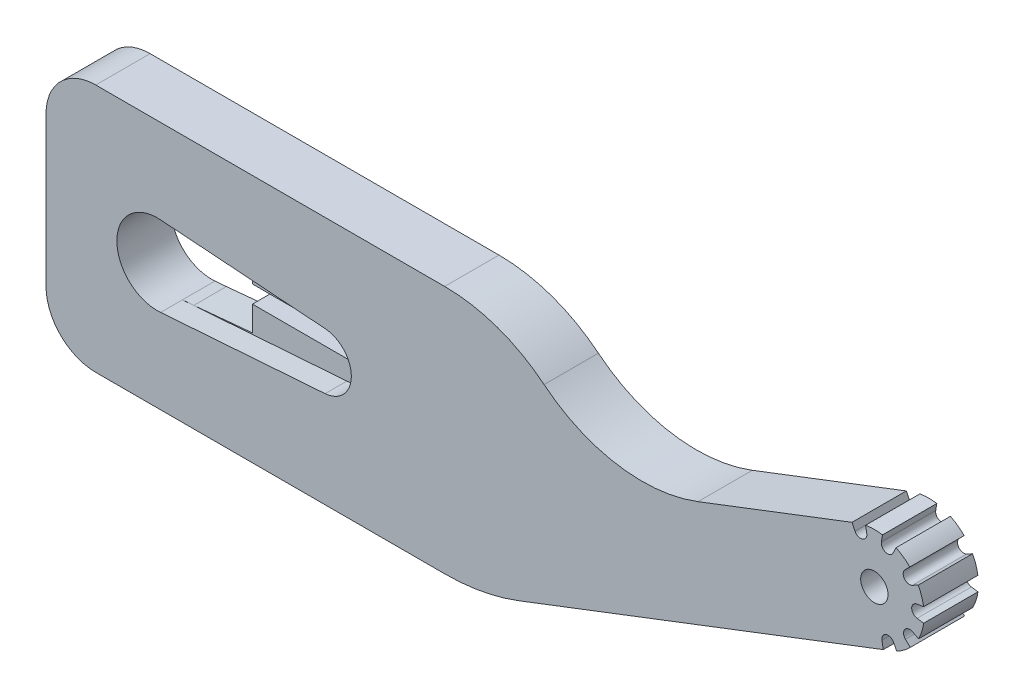
from build123d import *
from build123d.topology import SkipClean

# Parameters (mm, degrees)
CROQUIS1_R              = 1.717841821
CROQUIS1_R_2            = 1.259750669
CROQUIS1_W              = 27.485469141
CROQUIS1_H              = 14.887962451
SALIENTE_EXTRUIR1_DEPTH = 5
SALIENTE_EXTRUIR2_START = -5
SALIENTE_EXTRUIR2_DEPTH = 5
CORTAR_EXTRUIR1_DEPTH   = 5
CORTAR_EXTRUIR2_DEPTH   = 2
CUT_EXTRUDE2_DEPTH      = 83.704538261
CUT_EXTRUDE5_DEPTH      = 83.704538261


with BuildPart() as part:
    # Croquis1 → Saliente-Extruir1 (new body)
    with BuildSketch(Plane(origin=(0, 0, -2.5), x_dir=(-1, 0, 0), z_dir=(0, 0, -1))):
        with BuildLine():
            Line((2.183126414, 10.199004786), (2.457799007, 10.747834714))
            ThreePointArc((2.457799007, 10.747834714), (3.150356623, 11.03498533), (3.533498829, 10.390552574))
            Line((3.533498829, 10.390552574), (3.410556906, 9.704532228))
            Line((3.410556906, 9.704532228), (36.957948904, -3.17310503))
            ThreePointArc((36.957948904, -3.17310503), (40.309989238, -4.118478177), (43.778179918, -4.437160132))
            Line((43.778179918, -4.437160132), (75.884737747, -4.437160132))
            ThreePointArc((75.884737747, -4.437160132), (79.123931349, -3.095442211), (80.46564927, 0.143751392))
            Line((80.46564927, 0.143751392), (80.46564927, 13.886485962))
            ThreePointArc((80.46564927, 13.886485962), (79.123931349, 17.125679564), (75.884737747, 18.467397485))
            Line((75.884737747, 18.467397485), (43.778179918, 18.467397485))
            ThreePointArc((43.778179918, 18.467397485), (38.923372817, 17.631925595), (34.62713443, 15.221634951))
            ThreePointArc((34.62713443, 15.221634951), (27.84817952, 12.197288027), (20.46564927, 12.971336544))
            Line((20.46564927, 12.971336544), (6.293279019, 18.411599775))
            Line((6.293279019, 18.411599775), (6.008822105, 17.843219559))
            ThreePointArc((6.008822105, 17.843219559), (5.316264489, 17.556068943), (4.933122282, 18.200501699))
            Line((4.933122282, 18.200501699), (5.041383533, 18.804603367))
            ThreePointArc((5.041383533, 18.804603367), (4.263160644, 18.876341405), (3.484068945, 18.814751339))
            Line((3.484068945, 18.814751339), (3.584448287, 18.209290101))
            ThreePointArc((3.584448287, 18.209290101), (3.192940304, 17.56990522), (2.504183677, 17.866056933))
            Line((2.504183677, 17.866056933), (2.236686818, 18.418419815))
            ThreePointArc((2.236686818, 18.418419815), (1.564924714, 18.019029169), (0.970828021, 17.511263148))
            Line((0.970828021, 17.511263148), (1.407917802, 17.080436215))
            ThreePointArc((1.407917802, 17.080436215), (1.467002194, 16.333040361), (0.735712768, 16.167791142))
            Line((0.735712768, 16.167791142), (0.194632507, 16.457431391))
            ThreePointArc((0.194632507, 16.457431391), (-0.114078519, 15.739465714), (-0.296255461, 14.9794731))
            Line((-0.296255461, 14.9794731), (0.310591317, 14.887841716))
            ThreePointArc((0.310591317, 14.887841716), (0.797699855, 14.317914702), (0.303205335, 13.754384137))
            Line((0.303205335, 13.754384137), (-0.304784058, 13.670669023))
            ThreePointArc((-0.304784058, 13.670669023), (-0.132526888, 12.9083668), (0.16680132, 12.18643894))
            Line((0.16680132, 12.18643894), (0.711610253, 12.469003179))
            ThreePointArc((0.711610253, 12.469003179), (1.440684032, 12.294237755), (1.371864517, 11.547675365))
            Line((1.371864517, 11.547675365), (0.929197275, 11.122581216))
            ThreePointArc((0.929197275, 11.122581216), (1.516626257, 10.607115987), (2.183126414, 10.199004786))
        make_face()
        with Locations(Location((46.05155145, 7.015118677, 0), (0, 0, 180))):
            Circle(CROQUIS1_R, mode=Mode.SUBTRACT)
        with Locations(Location((77.659840962, 7.015118677, 0), (0, 0, 180))):
            Circle(CROQUIS1_R, mode=Mode.SUBTRACT)
        with Locations(Location((4.233310556, 14.295527136, 0), (0, 0, 180))):
            Circle(CROQUIS1_R_2, mode=Mode.SUBTRACT)
        with Locations((61.855696206, 7.015118677)):
            Rectangle(CROQUIS1_W, CROQUIS1_H, mode=Mode.SUBTRACT)
    extrude(amount=-SALIENTE_EXTRUIR1_DEPTH)

    # Croquis2 → Saliente-Extruir2 (add)
    with BuildSketch(Plane.XY.offset(2.5).offset(SALIENTE_EXTRUIR2_START)):
        with BuildLine():
            Line((-43.778179918, -4.437160132), (-75.884737747, -4.437160132))
            ThreePointArc((-75.884737747, -4.437160132), (-79.123931349, -3.095442211), (-80.46564927, 0.143751392))
            Line((-80.46564927, 0.143751392), (-80.46564927, 13.886485962))
            ThreePointArc((-80.46564927, 13.886485962), (-79.123931349, 17.125679564), (-75.884737747, 18.467397485))
            Line((-75.884737747, 18.467397485), (-43.778179918, 18.467397485))
            Line((-43.778179918, 18.467397485), (-43.778179918, -4.437160132))
        make_face()
    extrude(amount=SALIENTE_EXTRUIR2_DEPTH)

    # Croquis3 → Cortar-Extruir1 (cut)
    with BuildSketch(Plane.XY.offset(2.5)):
        with BuildLine():
            Line((-68.86564927, 10.615118677), (-63.46564927, 10.110118677))
            Line((-63.46564927, 10.110118677), (-63.46564927, 3.920118677))
            Line((-63.46564927, 3.920118677), (-68.86564927, 3.415118677))
            ThreePointArc((-68.86564927, 3.415118677), (-72.46564927, 7.015118677), (-68.86564927, 10.615118677))
        make_face()
    extrude(amount=-CORTAR_EXTRUIR1_DEPTH, mode=Mode.SUBTRACT)

    # Croquis4 → Cortar-Extruir2 (cut)
    with BuildSketch(Plane.XY.offset(2.5)):
        with BuildLine():
            Line((-54.77859891, 9.608381518), (-69.913267682, 10.700035319))
            ThreePointArc((-69.913267682, 10.700035319), (-73.947018097, 7.015118677), (-69.913267682, 3.330202034))
            Line((-69.913267682, 3.330202034), (-54.77859891, 4.421855836))
            ThreePointArc((-54.77859891, 4.421855836), (-52.36564927, 7.015118677), (-54.77859891, 9.608381518))
        make_face()
    extrude(amount=-CORTAR_EXTRUIR2_DEPTH, mode=Mode.SUBTRACT)

    # Sketch2 → Cut-Extrude2 (cut, through all)
    with SkipClean():  # the faces are left unmerged after this step: merging them gives an invalid solid
        with BuildSketch(Plane.XY.offset(0.5)):
            with BuildLine():
                Line((-69.913267682, 10.700035319), (-68.86564927, 10.615118677))
                ThreePointArc((-68.86564927, 10.615118677), (-72.46564927, 7.015118677), (-68.86564927, 3.415118677))
                Line((-68.86564927, 3.415118677), (-69.913267682, 3.330202034))
                ThreePointArc((-69.913267682, 3.330202034), (-73.947018097, 7.015118677), (-69.913267682, 10.700035319))
            make_face()
        extrude(amount=-CUT_EXTRUDE2_DEPTH, mode=Mode.SUBTRACT)

    # Sketch5 → Cut-Extrude5 (cut, through all)
    with SkipClean():  # the faces are left unmerged after this step: merging them gives an invalid solid
        with BuildSketch(Plane.XY.offset(0.5)):
            with BuildLine():
                Line((-63.46564927, 7.815118677), (-53.96564927, 7.815118677))
                ThreePointArc((-53.96564927, 7.815118677), (-53.16564927, 7.015118677), (-53.96564927, 6.215118677))
                Line((-53.96564927, 6.215118677), (-63.46564927, 6.215118677))
                Line((-63.46564927, 6.215118677), (-63.46564927, 7.815118677))
            make_face()
        extrude(amount=-CUT_EXTRUDE5_DEPTH, mode=Mode.SUBTRACT)


solid = part.part
